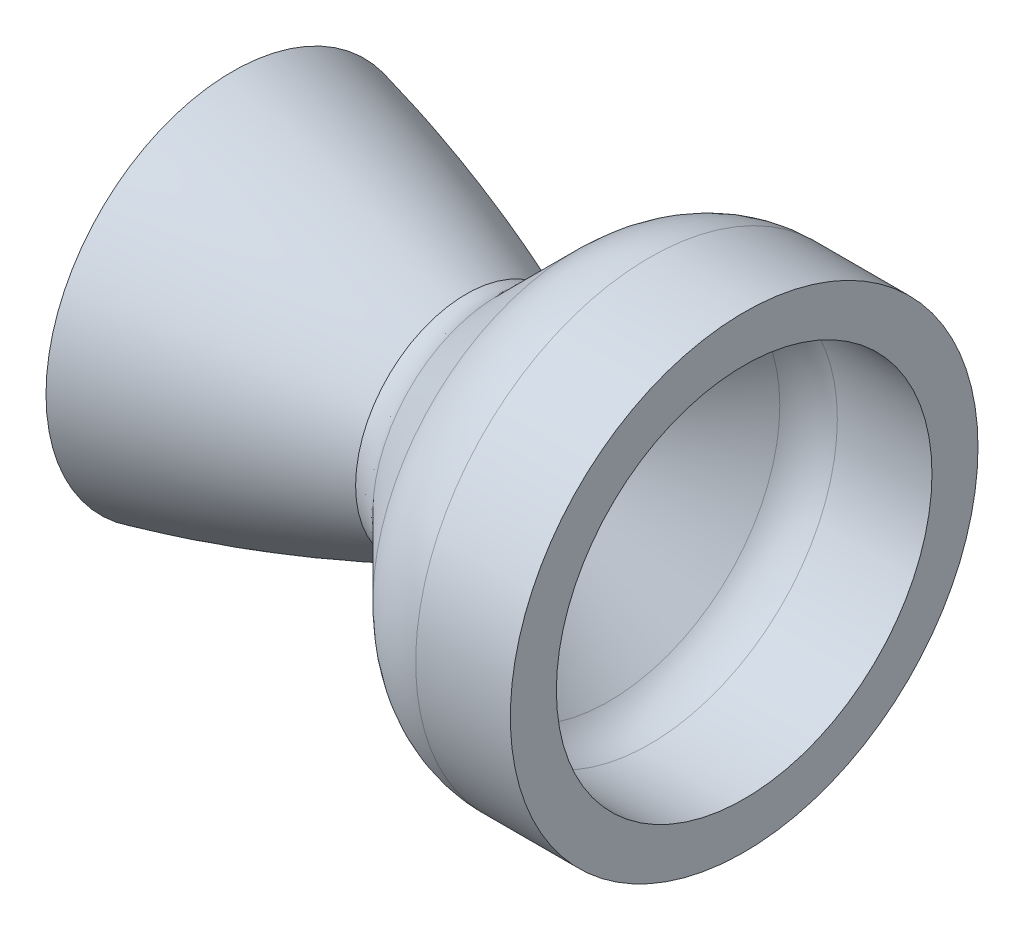
from build123d import *


with BuildPart() as part:
    # Sketch1 → Revolve1 (revolve)
    with BuildSketch(Plane.XY, mode=Mode.PRIVATE) as revolve1_sk:
        with BuildLine():
            Line((50.674568212, 32.653330611), (34.216224259, 32.653330611))
            ThreePointArc((34.216224259, 32.653330611), (30.389389936, 31.892125936), (27.145156447, 29.724398423))
            Line((27.145156447, 29.724398423), (13.5413641, 16.120606076))
            ThreePointArc((13.5413641, 16.120606076), (8.09105184, 12.478823854), (1.661970177, 11.2))
            ThreePointArc((1.661970177, 11.2), (0.814173455, 11.284839785), (0, 11.535994428))
            add(Edge.make_bspline(
                [(0, 11.535994428), (-19.935169187, 19.939913318), (-40.096604749, 24.629816077)],
                knots=[0, 0, 0, 1, 1, 1], degree=2))
            Line((-40.096604749, 24.629816077), (-38.284057984, 32.421778232))
            add(Edge.make_bspline(
                [(2.347693545, 19.226757529), (-17.814473556, 27.657584683), (-38.284057984, 32.421778232)],
                knots=[0.018502695, 0.018502695, 0.018502695, 1, 1, 1], degree=2))
            ThreePointArc((2.347693545, 19.226757529), (5.344027449, 20.007349986), (7.884509851, 21.777460326))
            Line((7.884509851, 21.777460326), (21.488302198, 35.381252672))
            ThreePointArc((21.488302198, 35.381252672), (27.327922477, 39.283162196), (34.216224259, 40.653330611))
            Line((34.216224259, 40.653330611), (50.674568212, 40.653330611))
            Line((50.674568212, 40.653330611), (50.674568212, 32.653330611))
        make_face()
    revolve(revolve1_sk.sketch.rotate(Axis((0, 0, 0), (-1, 0, 0)), 90), axis=Axis((0, 0, 0), (-1, 0, 0)))


solid = part.part
